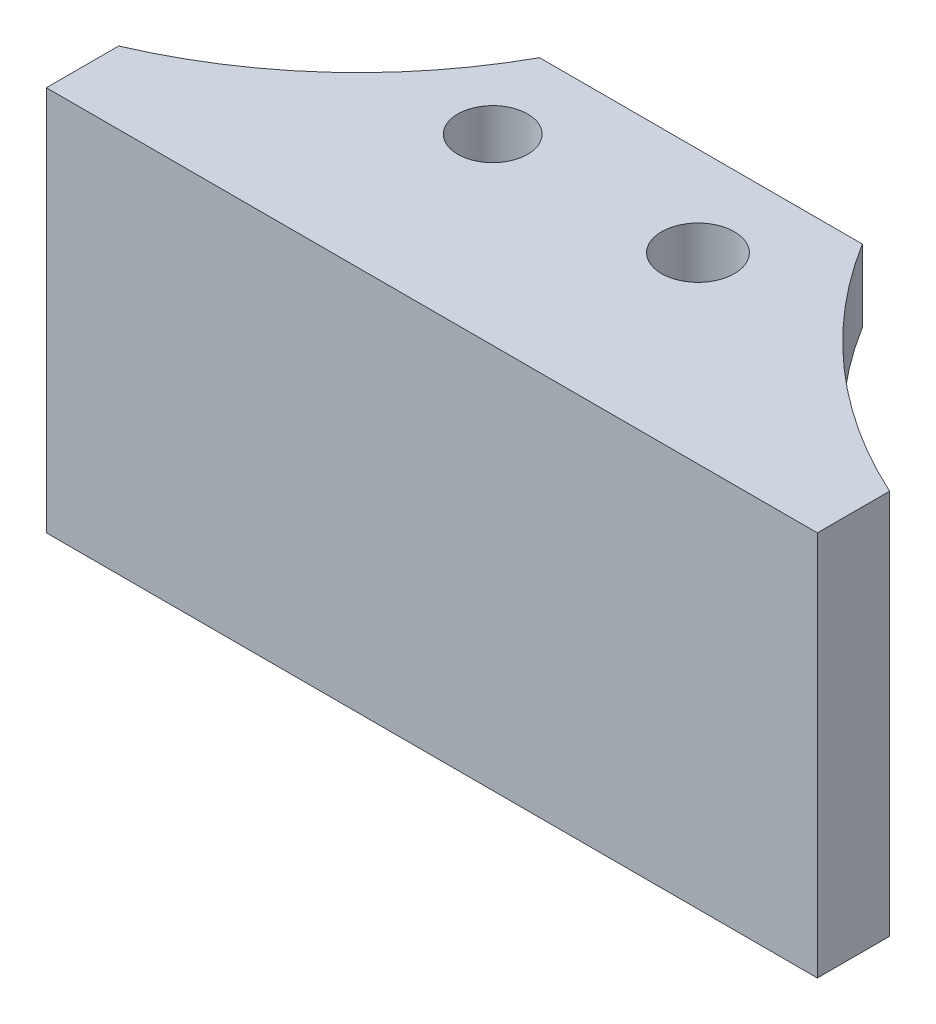
from build123d import *

# Parameters (mm, degrees)
SKETCH1_W           = 160
SKETCH1_H           = 80
BOSS_EXTRUDE1_DEPTH = 15
SKETCH2_R           = 7.550070769
SKETCH2_R_2         = 7.255415261
BOSS_EXTRUDE2_DEPTH = 15


with BuildPart() as part:
    # Sketch1 → Boss-Extrude1 (new body)
    with BuildSketch(Plane.XY):
        with Locations((80, 40)):
            Rectangle(SKETCH1_W, SKETCH1_H)
    extrude(amount=BOSS_EXTRUDE1_DEPTH)

    # Sketch2 → Boss-Extrude2 (add)
    with BuildSketch(Plane(origin=(0, 80, 0), x_dir=(1, 0, 0), z_dir=(0, 1, 0))):
        with BuildLine():
            ThreePointArc((112.765660055, 41.575459997), (133.290805297, 17.274846503), (160, 0))
            Line((160, 0), (0, 0))
            ThreePointArc((0, 0), (26.372008671, 16.953021182), (45.778792932, 41.575459997))
            Line((45.778792932, 41.575459997), (112.765660055, 41.575459997))
        make_face()
        with Locations(Location((97.257304614, 22.969928459, 0), (0, 0, 270))):
            Circle(SKETCH2_R, mode=Mode.SUBTRACT)
        with Locations(Location((54.653333848, 22.969928459, 0), (0, 0, 270))):
            Circle(SKETCH2_R_2, mode=Mode.SUBTRACT)
    extrude(amount=-BOSS_EXTRUDE2_DEPTH)


solid = part.part
